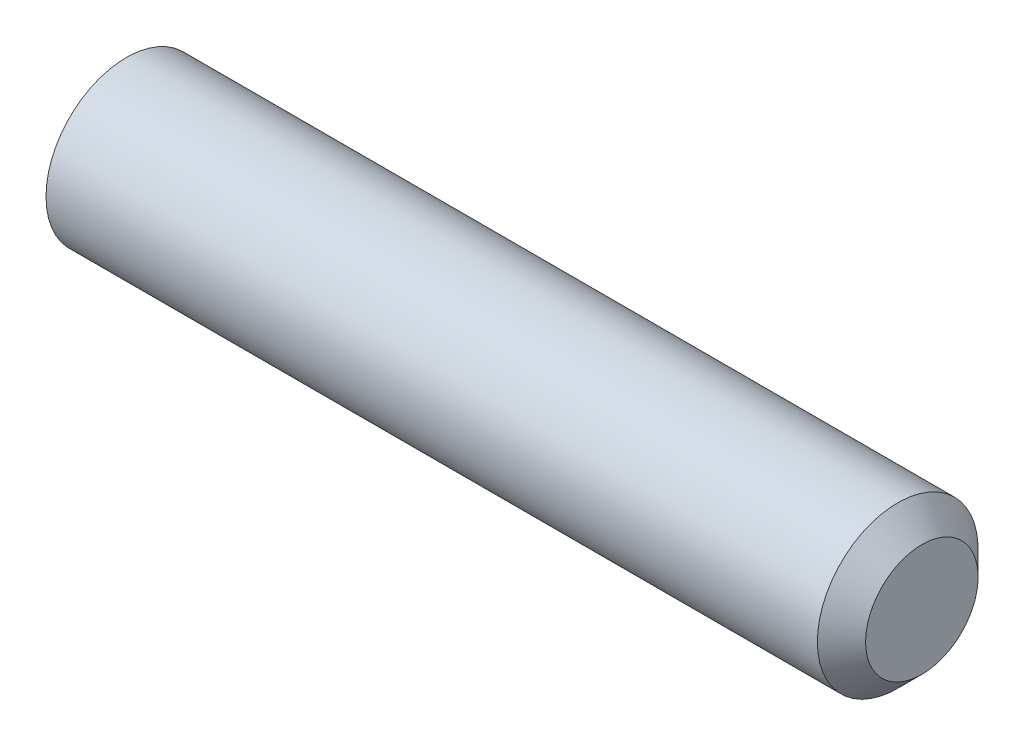
from build123d import *


with BuildPart() as part:
    # BodySke → BaseBody (revolve)
    with BuildSketch(Plane.XY, mode=Mode.PRIVATE) as basebody_sk:
        Polygon((0, 0), (0, 2.055), (0.25692087, 2.5), (24.25, 2.5), (25, 1.75), (25, 0), align=None)
    revolve(basebody_sk.sketch.rotate(Axis((-12.7, 0, 0), (1, 0, 0)), 90), axis=Axis((-12.7, 0, 0), (1, 0, 0)))


solid = part.part
